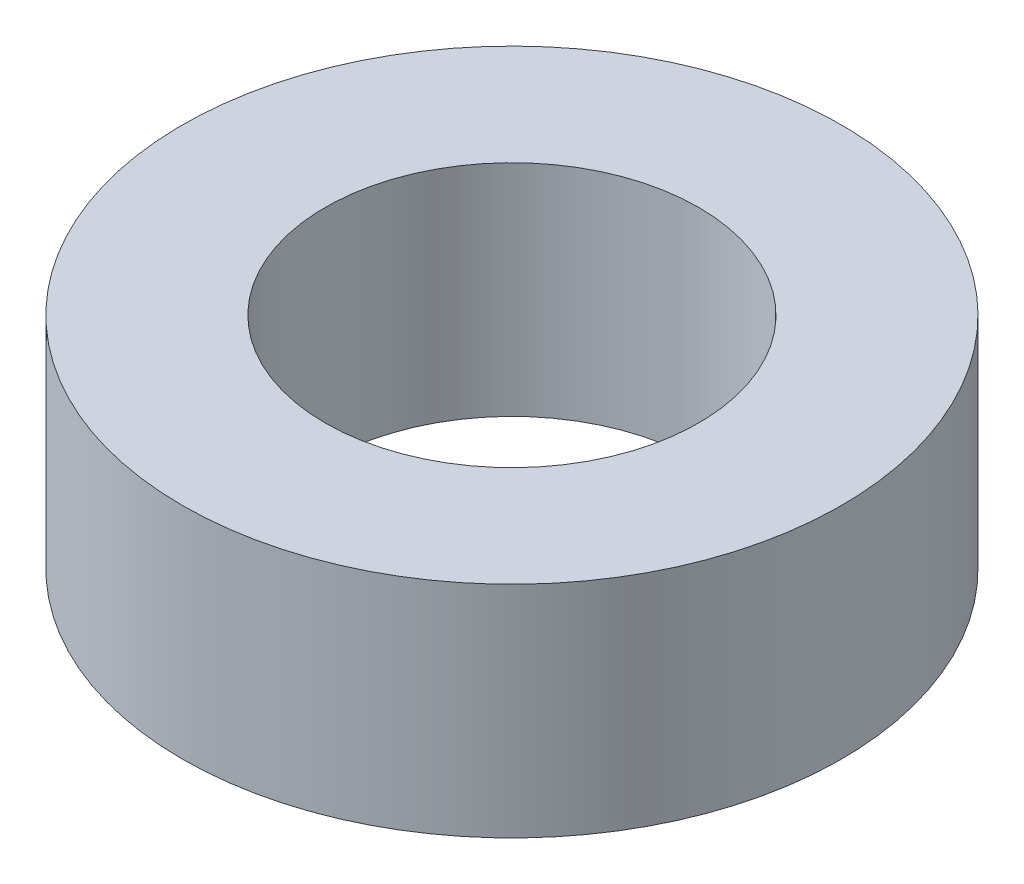
from build123d import *

# Parameters (mm, degrees)
SKETCH1_R           = 15
SKETCH1_R_2         = 8.5
BOSS_EXTRUDE1_DEPTH = 5


with BuildPart() as part:
    # Sketch1 → Boss-Extrude1 (new, symmetric)
    with BuildSketch(Plane(origin=(0, 0, 0), x_dir=(1, 0, 0), z_dir=(0, 1, 0))):
        with Locations(Location((0, 0, 0), (0, 0, 270))):
            Circle(SKETCH1_R)
        with Locations(Location((0, 0, 0), (0, 0, 270))):
            Circle(SKETCH1_R_2, mode=Mode.SUBTRACT)
    extrude(amount=BOSS_EXTRUDE1_DEPTH, both=True)


solid = part.part
